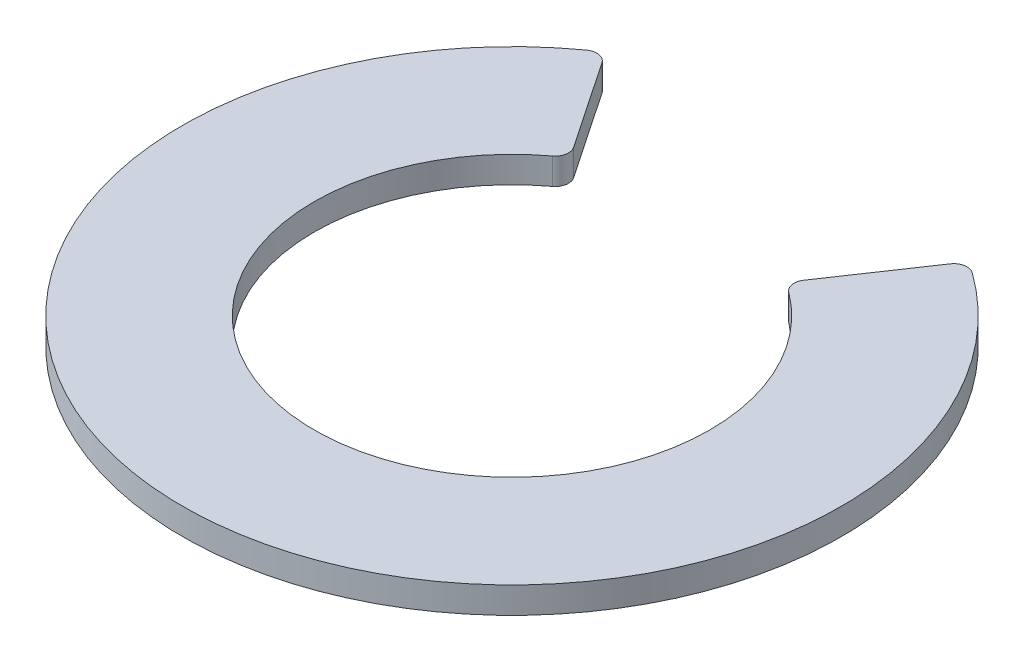
from build123d import *

# Parameters (mm, degrees)
BOSS_EXTRUDE1_DEPTH = 0.2


with BuildPart() as part:
    # Sketch1 → Boss-Extrude1 (new body)
    with BuildSketch(Plane(origin=(0, 0, 0), x_dir=(1, 0, 0), z_dir=(0, 1, 0))):
        with BuildLine():
            Line((-1.320517138, 2.002885703), (-0.872477251, 1.339440219))
            ThreePointArc((-0.872477251, 1.339440219), (-0.856765563, 1.266706547), (-0.895640353, 1.203257395))
            ThreePointArc((-0.895640353, 1.203257395), (0, -1.5), (0.895640353, 1.203257395))
            ThreePointArc((0.895640353, 1.203257395), (0.856765563, 1.266706547), (0.872477251, 1.339440219))
            Line((0.872477251, 1.339440219), (1.320517138, 2.002885703))
            ThreePointArc((1.320517138, 2.002885703), (1.385867599, 2.04537297), (1.461864164, 2.028041707))
            ThreePointArc((1.461864164, 2.028041707), (0, -2.5), (-1.461864164, 2.028041707))
            ThreePointArc((-1.461864164, 2.028041707), (-1.385867599, 2.04537297), (-1.320517138, 2.002885703))
        make_face()
    extrude(amount=BOSS_EXTRUDE1_DEPTH)


solid = part.part
